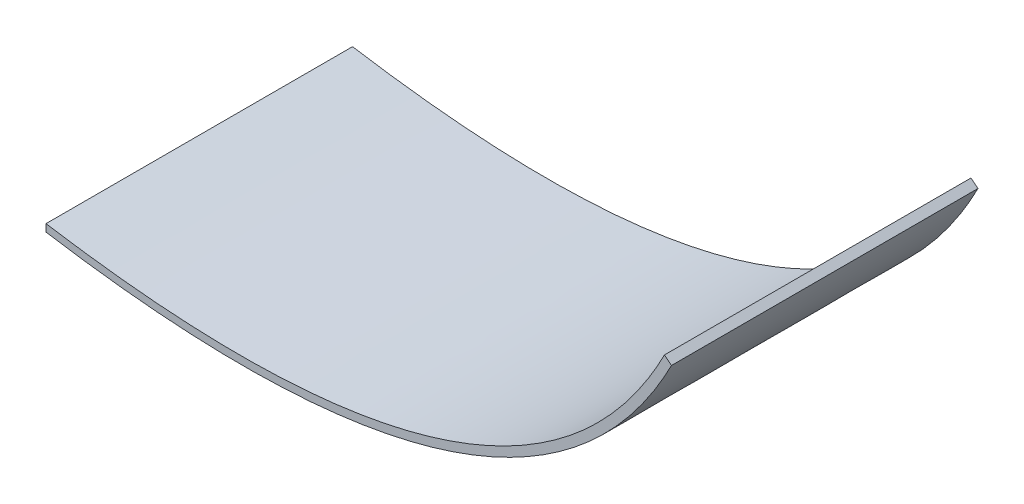
from build123d import *

# Parameters (mm, degrees)
BOSS_EXTRUDE1_DEPTH = 203.2


with BuildPart() as part:
    # Sketch1 → Boss-Extrude1 (new body)
    with BuildSketch(Plane.XY):
        with BuildLine():
            Line((-320.50923521, 56.543288118), (-320.515675822, 51.642935818))
            add(Edge.make_bspline(
                [(-320.515675822, 51.642935818), (0, 0), (94.169461642, 182.449989511)],
                knots=[0, 0, 0, 1, 1, 1], degree=2))
            Line((94.169461642, 182.449989511), (89.485957247, 186.135672215))
            add(Edge.make_bspline(
                [(-320.50923521, 56.543288118), (-3.744618922, 5.504739983), (89.485957247, 186.135672215)],
                knots=[0, 0, 0, 1, 1, 1], degree=2))
        make_face()
    extrude(amount=BOSS_EXTRUDE1_DEPTH)


solid = part.part
